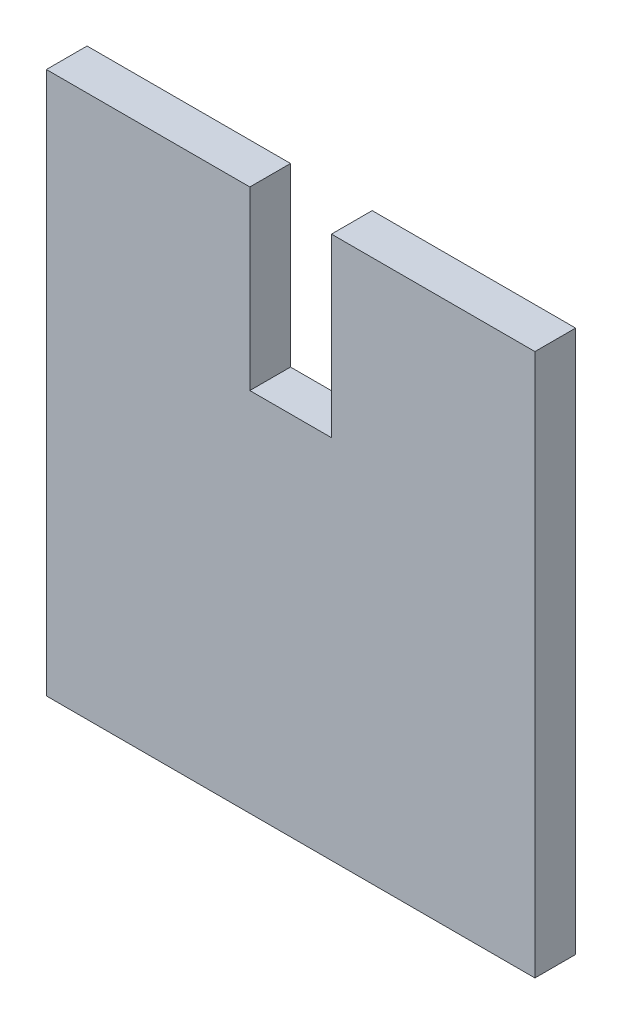
from build123d import *

# Parameters (mm, degrees)
BOSS_EXTRUDE1_DEPTH = 6


with BuildPart() as part:
    # Sketch1 → Boss-Extrude1 (new body)
    with BuildSketch(Plane.XY):
        Polygon((0, 0), (0, 80), (30, 80), (30, 54), (42.04, 54), (42.04, 80), (72.04, 80), (72.04, 0), align=None)
    extrude(amount=BOSS_EXTRUDE1_DEPTH)


solid = part.part
